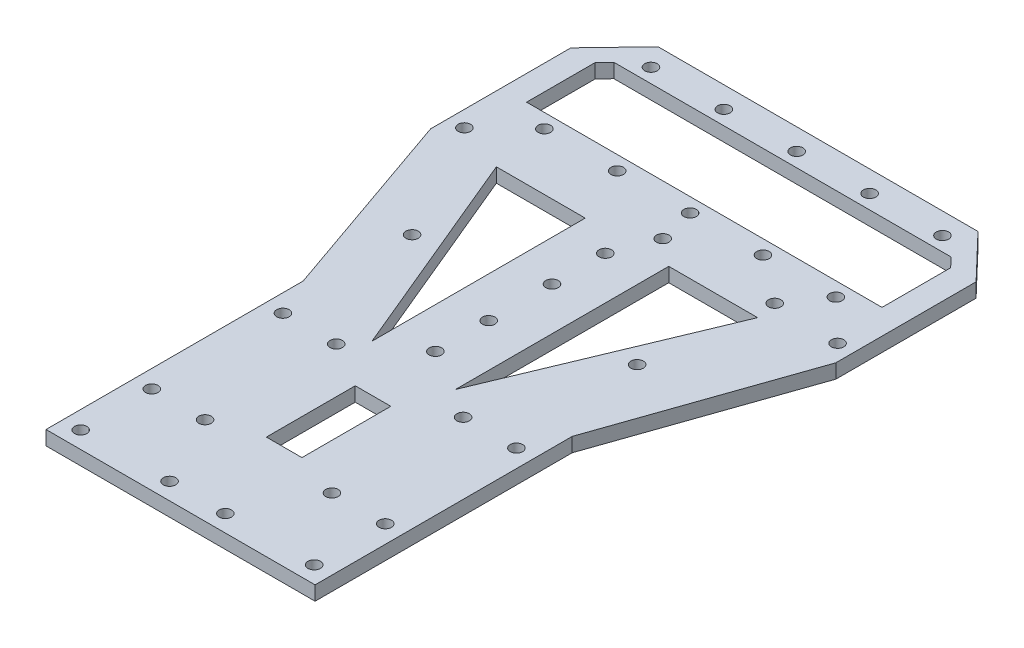
from build123d import *

# Parameters (mm, degrees)
SKETCH1_W           = 75.7
SKETCH1_H           = 42.7
SKETCH1_R           = 1.75
BOSS_EXTRUDE1_DEPTH = 4
SKETCH3_W           = 75.7
SKETCH3_H           = 29.75
SKETCH3_R           = 1.75
BOSS_EXTRUDE2_DEPTH = 4
SKETCH3_3_R         = 1.75
CUT_EXTRUDE1_DEPTH  = 4
SKETCH4_W           = 75.7
SKETCH4_H           = 43.4
SKETCH4_R           = 1.75
BOSS_EXTRUDE3_DEPTH = 4
BOSS_EXTRUDE4_DEPTH = 4
SKETCH6_3_R         = 1.75
CUT_EXTRUDE2_DEPTH  = 111.432105839
SKETCH7_W           = 19.15
SKETCH7_H           = 10
SKETCH7_R           = 1.75
BOSS_EXTRUDE5_DEPTH = 4
SKETCH8_W           = 75.7
SKETCH8_H           = 21.5
BOSS_EXTRUDE6_DEPTH = 4
SKETCH9_R           = 1.75
CUT_EXTRUDE3_DEPTH  = 130.309705746
BOSS_EXTRUDE7_DEPTH = 4
CUT_EXTRUDE4_DEPTH  = 4
SKETCH12_W          = 10
SKETCH12_H          = 25
CUT_EXTRUDE5_DEPTH  = 10
SKETCH13_R          = 1.75
BOSS_EXTRUDE8_DEPTH = 4


with BuildPart() as part:
    # Sketch1 → Boss-Extrude1 (new body)
    with BuildSketch(Plane(origin=(0, 0, 0), x_dir=(1, 0, 0), z_dir=(0, 1, 0))):
        Rectangle(SKETCH1_W, SKETCH1_H)
        with Locations(Location((2.4, 17.25, 0), (0, 0, 270))):
            Circle(SKETCH1_R, mode=Mode.SUBTRACT)
        with Locations(Location((-33.8, -17.05, 0), (0, 0, 270))):
            Circle(SKETCH1_R, mode=Mode.SUBTRACT)
        with Locations(Location((29.5, -17.05, 0), (0, 0, 270))):
            Circle(SKETCH1_R, mode=Mode.SUBTRACT)
        with Locations(Location((33.9, 17.25, 0), (0, 0, 270))):
            Circle(SKETCH1_R, mode=Mode.SUBTRACT)
    extrude(amount=BOSS_EXTRUDE1_DEPTH)

    # Sketch3 → Boss-Extrude2 (add)
    # profile 1 of 2: a face of its own
    with BuildSketch(Plane(origin=(0, 4, 0), x_dir=(1, 0, 0), z_dir=(0, 1, 0))):
        with Locations((0, -36.225)):
            Rectangle(SKETCH3_W, SKETCH3_H)
        with Locations(Location((-2.1, -42.2, 0), (0, 0, 270))):
            Circle(SKETCH3_R, mode=Mode.SUBTRACT)
        with Locations(Location((-2.1, -27.2, 0), (0, 0, 270))):
            Circle(SKETCH3_R, mode=Mode.SUBTRACT)
    # profile 2 of 2: a face of its own
    with BuildSketch(Plane(origin=(0, 4, 0), x_dir=(1, 0, 0), z_dir=(0, 1, 0))):
        with BuildLine():
            Line((-2.1, -25.45), (-2.1, -21.35))
            Line((-2.1, -21.35), (-37.85, -21.35))
            Line((-37.85, -21.35), (-37.85, -51.1))
            Line((-37.85, -51.1), (-2.1, -51.1))
            Line((-2.1, -51.1), (-2.1, -43.95))
            ThreePointArc((-2.1, -43.95), (-3.85, -42.2), (-2.1, -40.45))
            Line((-2.1, -40.45), (-2.1, -28.95))
            ThreePointArc((-2.1, -28.95), (-3.85, -27.2), (-2.1, -25.45))
        make_face()
    extrude(amount=-BOSS_EXTRUDE2_DEPTH)

    # Sketch3<3> → Cut-Extrude1 (cut)
    with BuildSketch(Plane(origin=(0, 4, 0), x_dir=(1, 0, 0), z_dir=(0, 1, 0))):
        with Locations(Location((-2.1, 5.6, 0), (0, 0, 270))):
            Circle(SKETCH3_3_R)
        with Locations(Location((-2.1, -9.4, 0), (0, 0, 270))):
            Circle(SKETCH3_3_R)
    extrude(amount=-CUT_EXTRUDE1_DEPTH, mode=Mode.SUBTRACT)

    # Sketch4 → Boss-Extrude3 (add)
    # profile 1 of 2: a face of its own
    with BuildSketch(Plane(origin=(0, 0, 0), x_dir=(1, 0, 0), z_dir=(0, 1, 0))):
        with Locations((0, -72.8)):
            Rectangle(SKETCH4_W, SKETCH4_H)
        with Locations(Location((-32.85, -54.35, 0), (0, 0, 270))):
            Circle(SKETCH4_R, mode=Mode.SUBTRACT)
        with Locations(Location((-17.85, -54.35, 0), (0, 0, 270))):
            Circle(SKETCH4_R, mode=Mode.SUBTRACT)
        with Locations(Location((-17.85, -91.25, 0), (0, 0, 270))):
            Circle(SKETCH4_R, mode=Mode.SUBTRACT)
        with Locations(Location((-32.85, -91.25, 0), (0, 0, 270))):
            Circle(SKETCH4_R, mode=Mode.SUBTRACT)
        with Locations(Location((32.85, -91.25, 0), (0, 0, 90))):
            Circle(SKETCH4_R, mode=Mode.SUBTRACT)
        with Locations(Location((17.85, -91.25, 0), (0, 0, 90))):
            Circle(SKETCH4_R, mode=Mode.SUBTRACT)
        with Locations(Location((17.85, -54.35, 0), (0, 0, 90))):
            Circle(SKETCH4_R, mode=Mode.SUBTRACT)
        with Locations(Location((32.85, -54.35, 0), (0, 0, 90))):
            Circle(SKETCH4_R, mode=Mode.SUBTRACT)
    # profile 2 of 2: a face of its own
    with BuildSketch(Plane(origin=(0, 0, 0), x_dir=(1, 0, 0), z_dir=(0, 1, 0))):
        Polygon((-37.85, 21.35), (-44, 21.35), (-44, 29.35), (44, 29.35), (44, 21.35), (37.85, 21.35), align=None)
    extrude(amount=BOSS_EXTRUDE3_DEPTH)

    # Sketch6 → Boss-Extrude4 (add)
    with BuildSketch(Plane(origin=(0, 4, 0), x_dir=(1, 0, 0), z_dir=(0, 1, 0))):
        Polygon((-57, 31.35), (-57, 29.35), (-57, 21.35), (-44, 21.35), (-44, 26.251387819), (-44, 29.35), (44, 29.35), (44, 26.251387819), (44, 21.35), (57, 21.35), (57, 29.35), (57, 31.35), align=None)
    extrude(amount=-BOSS_EXTRUDE4_DEPTH)

    # Sketch6<3> → Cut-Extrude2 (cut, through all)
    with BuildSketch(Plane(origin=(0, 4, 0), x_dir=(1, 0, 0), z_dir=(0, 1, 0))):
        with Locations(Location((0, 27.35, 0), (0, 0, 270))):
            Circle(SKETCH6_3_R)
        with Locations(Location((20.5, 27.35, 0), (0, 0, 270))):
            Circle(SKETCH6_3_R)
        with Locations(Location((41, 27.35, 0), (0, 0, 270))):
            Circle(SKETCH6_3_R)
        with Locations(Location((-20.5, 27.35, 0), (0, 0, 270))):
            Circle(SKETCH6_3_R)
        with Locations(Location((-41, 27.35, 0), (0, 0, 270))):
            Circle(SKETCH6_3_R)
    extrude(amount=-CUT_EXTRUDE2_DEPTH, mode=Mode.SUBTRACT)

    # Sketch7 → Boss-Extrude5 (add)
    # profile 1 of 2: a face of its own
    with BuildSketch(Plane(origin=(0, 0, 0), x_dir=(1, 0, 0), z_dir=(0, 1, 0))):
        with Locations((-47.425, 16.35)):
            Rectangle(SKETCH7_W, SKETCH7_H)
        with Locations(Location((-52.5, 16.35, 0), (0, 0, 270))):
            Circle(SKETCH7_R, mode=Mode.SUBTRACT)
    # profile 2 of 2: a face of its own
    with BuildSketch(Plane(origin=(0, 0, 0), x_dir=(1, 0, 0), z_dir=(0, 1, 0))):
        with Locations((47.425, 16.35)):
            Rectangle(SKETCH7_W, SKETCH7_H)
        with Locations(Location((52.5, 16.35, 0), (0, 0, 270))):
            Circle(SKETCH7_R, mode=Mode.SUBTRACT)
    extrude(amount=BOSS_EXTRUDE5_DEPTH)

    # Sketch8 → Boss-Extrude6 (add)
    with BuildSketch(Plane(origin=(0, 0, 0), x_dir=(1, 0, 0), z_dir=(0, 1, 0))):
        with Locations((0, -105.25)):
            Rectangle(SKETCH8_W, SKETCH8_H)
    extrude(amount=BOSS_EXTRUDE6_DEPTH)

    # Sketch9 → Cut-Extrude3 (cut, through all)
    with BuildSketch(Plane(origin=(0, 4, 0), x_dir=(1, 0, 0), z_dir=(0, 1, 0))):
        with Locations(Location((-7.85, -111.25, 0), (0, 0, 270))):
            Circle(SKETCH9_R)
        with Locations(Location((-32.85, -111.25, 0), (0, 0, 270))):
            Circle(SKETCH9_R)
    cut_extrude3 = extrude(amount=-CUT_EXTRUDE3_DEPTH, mode=Mode.SUBTRACT)

    # Mirror1: Cut-Extrude3 across plane
    add(cut_extrude3.mirror(Plane(origin=(0, 0, 0), x_dir=(0, 0, 1), z_dir=(1, 0, 0))), mode=Mode.SUBTRACT)

    # Sketch10 → Boss-Extrude7 (add)
    with BuildSketch(Plane(origin=(0, 4, 0), x_dir=(1, 0, 0), z_dir=(0, 1, 0))):
        Polygon((-57, 11.35), (-37.85, -43.65), (-37.85, 11.35), align=None)
        Polygon((57, 11.35), (37.85, -43.65), (37.85, 11.35), align=None)
    extrude(amount=-BOSS_EXTRUDE7_DEPTH)

    # Sketch11 → Cut-Extrude4 (cut)
    with BuildSketch(Plane(origin=(0, 4, 0), x_dir=(1, 0, 0), z_dir=(0, 1, 0))):
        Polygon((-38.5, 11.35), (-13.5, 11.35), (-13.5, -48.65), align=None)
        Polygon((10, 11.35), (35, 11.35), (10, -48.65), align=None)
    extrude(amount=-CUT_EXTRUDE4_DEPTH, mode=Mode.SUBTRACT)

    # Sketch12 → Cut-Extrude5 (cut)
    with BuildSketch(Plane(origin=(0, 4, 0), x_dir=(1, 0, 0), z_dir=(0, 1, 0))):
        with Locations((0, -74.35)):
            Rectangle(SKETCH12_W, SKETCH12_H)
    extrude(amount=-CUT_EXTRUDE5_DEPTH, mode=Mode.SUBTRACT)

    # Sketch13 → Boss-Extrude8 (add)
    with BuildSketch(Plane(origin=(0, 0, 0), x_dir=(1, 0, 0), z_dir=(0, 1, 0))):
        Polygon((-57, 31.35), (-57, 50.810693545), (-45, 63.35), (45, 63.35), (57, 50.810693545), (57, 31.35), (50, 31.35), (50, 50.657737172), (47.423529439, 53.35), (-47.423529439, 53.35), (-50, 50.657737172), (-50, 31.35), align=None)
        with Locations(Location((-41, 57.35, 0), (0, 0, 270))):
            Circle(SKETCH13_R, mode=Mode.SUBTRACT)
        with Locations(Location((-20.5, 57.35, 0), (0, 0, 270))):
            Circle(SKETCH13_R, mode=Mode.SUBTRACT)
        with Locations(Location((0, 57.35, 0), (0, 0, 270))):
            Circle(SKETCH13_R, mode=Mode.SUBTRACT)
        with Locations(Location((20.5, 57.35, 0), (0, 0, 270))):
            Circle(SKETCH13_R, mode=Mode.SUBTRACT)
        with Locations(Location((41, 57.35, 0), (0, 0, 270))):
            Circle(SKETCH13_R, mode=Mode.SUBTRACT)
    extrude(amount=BOSS_EXTRUDE8_DEPTH)


solid = part.part
